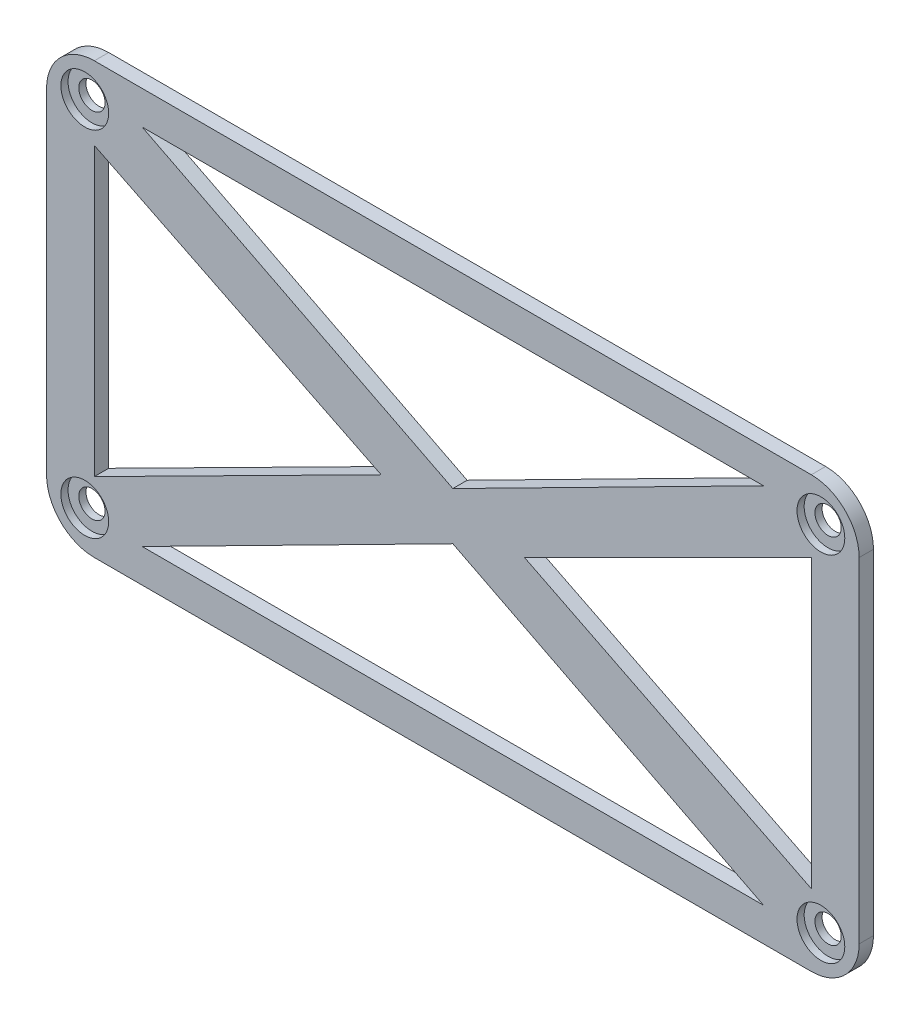
from build123d import *

# Parameters (mm, degrees)
EXTRUDE_1_DEPTH          = 3
CUT_EXTRUDE_1_DEPTH      = 39
CUT_EXTRUDE_1_DEPTH_BACK = 10
SKETCH_2_R               = 2.75
SKETCH_3_R               = 5
CUT_EXTRUDE_2_DEPTH      = 1.5


with BuildPart() as part:
    # 草图1 → 凸台-拉伸1 (new body)
    with BuildSketch(Plane.XY):
        with BuildLine():
            Line((-72.574116531, 45.487390308), (77.425883469, 45.487390308))
            ThreePointArc((77.425883469, 45.487390308), (84.496951281, 42.558458119), (87.425883469, 35.487390308))
            Line((87.425883469, 35.487390308), (87.425883469, -34.512609692))
            ThreePointArc((87.425883469, -34.512609692), (84.496951281, -41.583677504), (77.425883469, -44.512609692))
            Line((77.425883469, -44.512609692), (-72.574116531, -44.512609692))
            ThreePointArc((-72.574116531, -44.512609692), (-79.645184343, -41.583677504), (-82.574116531, -34.512609692))
            Line((-82.574116531, -34.512609692), (-82.574116531, 35.487390308))
            ThreePointArc((-82.574116531, 35.487390308), (-79.645184343, 42.558458119), (-72.574116531, 45.487390308))
        make_face()
    extrude(amount=EXTRUDE_1_DEPTH)

    # 草图2 → 切除-拉伸1 (cut, two sides: drawn at the far end of the back side and taken through both)
    with BuildSketch(Plane.XY.offset(3).offset(-CUT_EXTRUDE_1_DEPTH_BACK)):
        with Locations((-74.574116531, 37.487390308)):
            Circle(SKETCH_2_R)
        with Locations((-74.574116531, -36.512609692)):
            Circle(SKETCH_2_R)
        with Locations((79.425883469, 37.487390308)):
            Circle(SKETCH_2_R)
        with Locations((79.425883469, -36.512609692)):
            Circle(SKETCH_2_R)
        Polygon((-62.574116531, 38.487390308), (2.425883469, 5.487390308), (67.425883469, 38.487390308), align=None)
        Polygon((-72.574116531, 30.156085606), (-12.574116531, 0.487390308), (-72.574116531, -29.843914394), align=None)
        Polygon((2.425883469, -4.512609692), (-62.574116531, -37.512609692), (67.425883469, -37.512609692), align=None)
        Polygon((17.425883469, 0.487390308), (77.425883469, 30.487390308), (77.425883469, -29.512609692), align=None)
    extrude(amount=CUT_EXTRUDE_1_DEPTH + CUT_EXTRUDE_1_DEPTH_BACK, mode=Mode.SUBTRACT)

    # 草图3 → 切除-拉伸2 (cut)
    with BuildSketch(Plane.XY.offset(3)):
        with Locations((-74.574116531, 37.487390308)):
            Circle(SKETCH_3_R)
        with Locations((79.425883469, 37.487390308)):
            Circle(SKETCH_3_R)
        with Locations((79.425883469, -36.512609692)):
            Circle(SKETCH_3_R)
        with Locations((-74.574116531, -36.512609692)):
            Circle(SKETCH_3_R)
    extrude(amount=-CUT_EXTRUDE_2_DEPTH, mode=Mode.SUBTRACT)


solid = part.part
